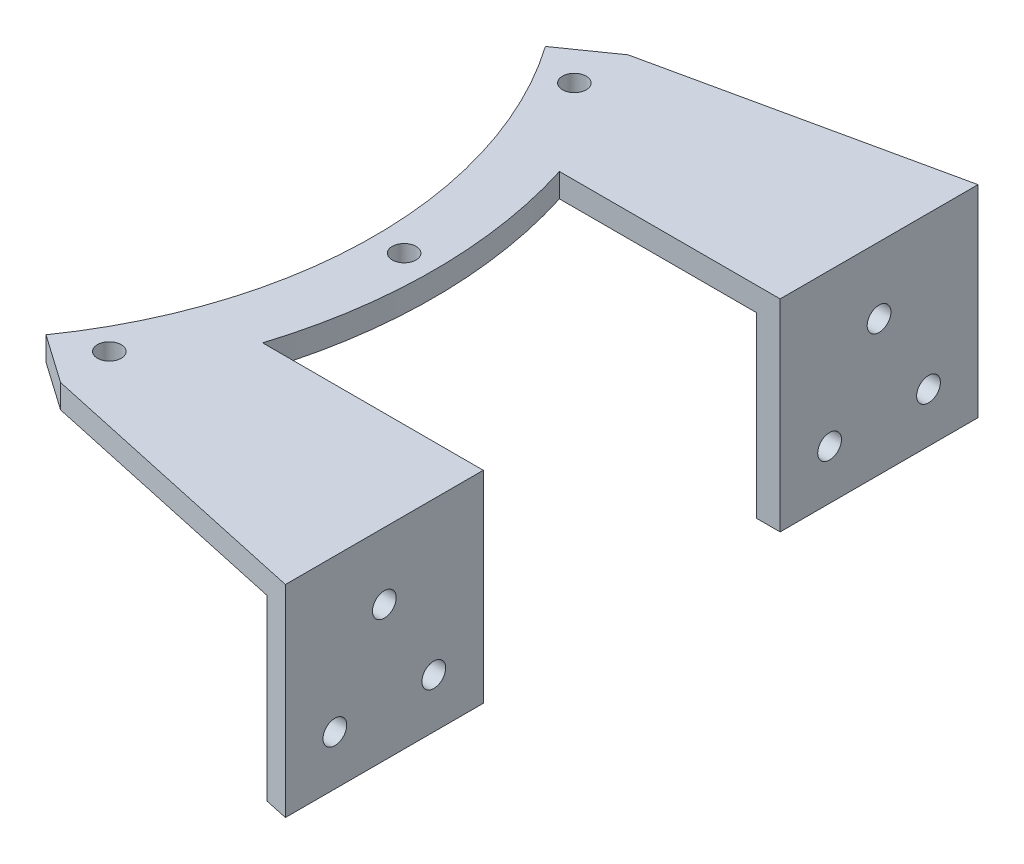
from build123d import *

# Parameters (mm, degrees)
SKETCH1_R           = 6
BOSS_EXTRUDE2_DEPTH = 12
BOSS_EXTRUDE3_DEPTH = 90
SKETCH4_R           = 6
CUT_EXTRUDE1_DEPTH  = 253.233216373


with BuildPart() as part:
    # Sketch1 → Boss-Extrude2 (new body)
    with BuildSketch(Plane(origin=(0, 0, 0), x_dir=(1, 0, 0), z_dir=(0, 1, 0))):
        with BuildLine():
            Line((350, 175), (350, 75))
            Line((350, 75), (238.484800354, 75))
            ThreePointArc((238.484800354, 75), (250, 0), (238.484800354, -75))
            Line((238.484800354, -75), (350, -75))
            Line((350, -75), (350, -175))
            Line((350, -175), (204.788011072, -143.394109088))
            Line((204.788011072, -143.394109088), (180.213449744, -126.186815997))
            ThreePointArc((180.213449744, -126.186815997), (220, 0), (180.213449744, 126.186815997))
            Line((180.213449744, 126.186815997), (204.788011072, 143.394109088))
            Line((204.788011072, 143.394109088), (350, 175))
        make_face()
        with Locations(Location((203.515969889, -117.5, 0), (0, 0, 270))):
            Circle(SKETCH1_R, mode=Mode.SUBTRACT)
        with Locations(Location((235, 0, 0), (0, 0, 270))):
            Circle(SKETCH1_R, mode=Mode.SUBTRACT)
        with Locations(Location((203.515969889, 117.5, 0), (0, 0, 270))):
            Circle(SKETCH1_R, mode=Mode.SUBTRACT)
    extrude(amount=BOSS_EXTRUDE2_DEPTH)

    # Sketch2 → Boss-Extrude3 (add)
    with BuildSketch(Plane(origin=(0, 0, 0), x_dir=(-1, 0, 0), z_dir=(0, -1, 0))):
        Polygon((-350, -175), (-350, -75), (-338, -75), (-338, -172.388158555), align=None)
        Polygon((-350, 75), (-350, 175), (-338, 172.388158555), (-338, 75), align=None)
    extrude(amount=BOSS_EXTRUDE3_DEPTH)

    # Sketch4 → Cut-Extrude1 (cut, through all)
    with BuildSketch(Plane.ZY.offset(-338)):
        with Locations((-150, -65)):
            Circle(SKETCH4_R)
        with Locations((-100, -65)):
            Circle(SKETCH4_R)
        with Locations((-125, -21.698729811)):
            Circle(SKETCH4_R)
        with Locations((150, -65)):
            Circle(SKETCH4_R)
        with Locations((125, -21.698729811)):
            Circle(SKETCH4_R)
        with Locations((100, -65)):
            Circle(SKETCH4_R)
    extrude(amount=-CUT_EXTRUDE1_DEPTH, mode=Mode.SUBTRACT)


solid = part.part
